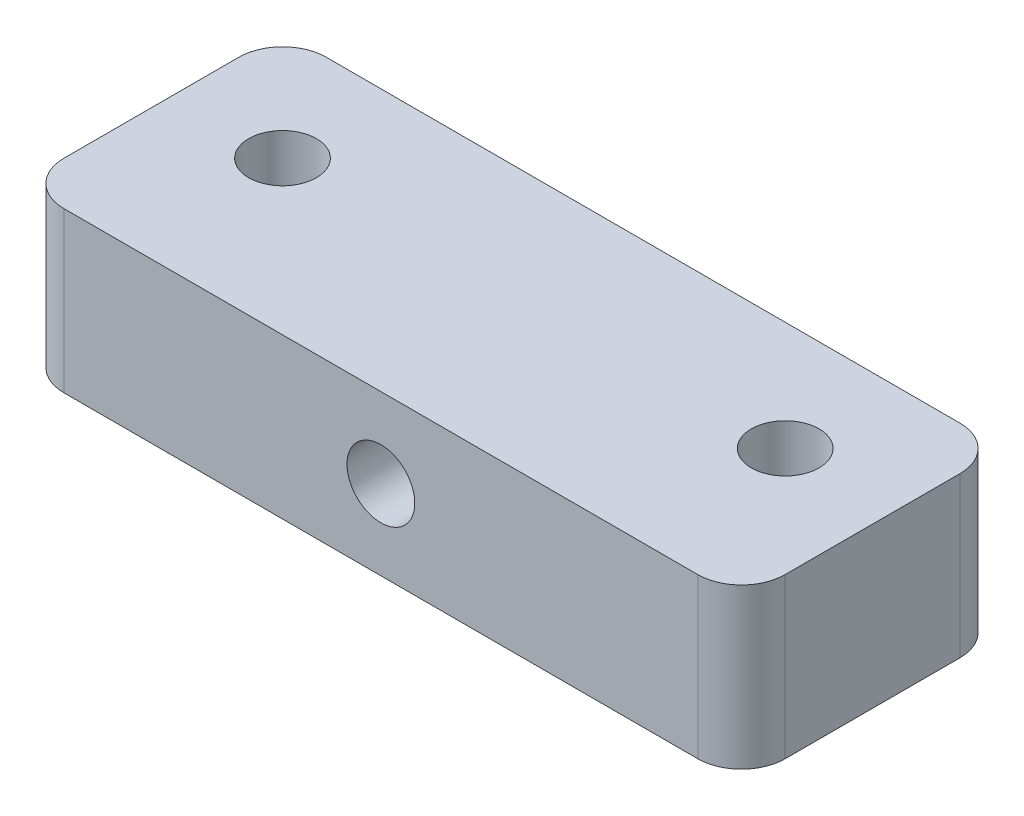
from build123d import *

# Parameters (mm, degrees)
ESQUISSE1_W             = 33
ESQUISSE1_H             = 12
ESQUISSE1_R             = 1.55
BOSS_EXTRU_1_DEPTH      = 3.65
ENL_V_START             = -3
ESQUISSE5_R             = 1.9
ENL_V_MAT_EXTRU_3_DEPTH = 19.668871683
CONG_1_R                = 2


with BuildPart() as part:
    # Esquisse1 → Boss.-Extru.1 (new, symmetric)
    with BuildSketch(Plane(origin=(0, 0, 0), x_dir=(1, 0, 0), z_dir=(0, 1, 0))):
        with Locations((0, 6)):
            Rectangle(ESQUISSE1_W, ESQUISSE1_H)
        with Locations(Location((-11.5, 7, 0), (0, 0, 270))):
            Circle(ESQUISSE1_R, mode=Mode.SUBTRACT)
        with Locations(Location((11.5, 7, 0), (0, 0, 90))):
            Circle(ESQUISSE1_R, mode=Mode.SUBTRACT)
    extrude(amount=BOSS_EXTRU_1_DEPTH, both=True)

    # Esquisse4 → Enlèvement de matière-Révolution1 (revolve, cut)
    with BuildSketch(Plane(origin=(0, 0, 0), x_dir=(0, 0, -1), z_dir=(1, 0, 0)), mode=Mode.PRIVATE) as enl_vement_de_mati_re_r_volution1_sk:
        Polygon((0, 0), (12, 0), (12, 2.337443318), (7, 1.9), (3, 1.9), (3, 1.55), (0, 1.55), align=None)
    revolve(enl_vement_de_mati_re_r_volution1_sk.sketch.rotate(Axis((0, 0, 12), (0, 0, -1)), 90), axis=Axis((0, 0, 12), (0, 0, -1)), mode=Mode.SUBTRACT)

    # Esquisse5 → Enlèv. mat.-Extru.3 (cut, through all)
    with BuildSketch(Plane(origin=(0, 3.65, 0), x_dir=(1, 0, 0), z_dir=(0, 1, 0)).offset(ENL_V_START)):
        with Locations(Location((-11.5, 7, 0), (0, 0, 270))):
            Circle(ESQUISSE5_R)
        with Locations(Location((11.5, 7, 0), (0, 0, 270))):
            Circle(ESQUISSE5_R)
    extrude(amount=-ENL_V_MAT_EXTRU_3_DEPTH, mode=Mode.SUBTRACT)

    # Congé1
    cong_1_edges = [part.edges().sort_by_distance(p)[0] for p in [
        (-16.5, 0, -12),
        (16.5, 0, -12),
        (16.5, 0, 0),
        (-16.5, 0, 0),
    ]]
    fillet(cong_1_edges, radius=CONG_1_R)


solid = part.part
